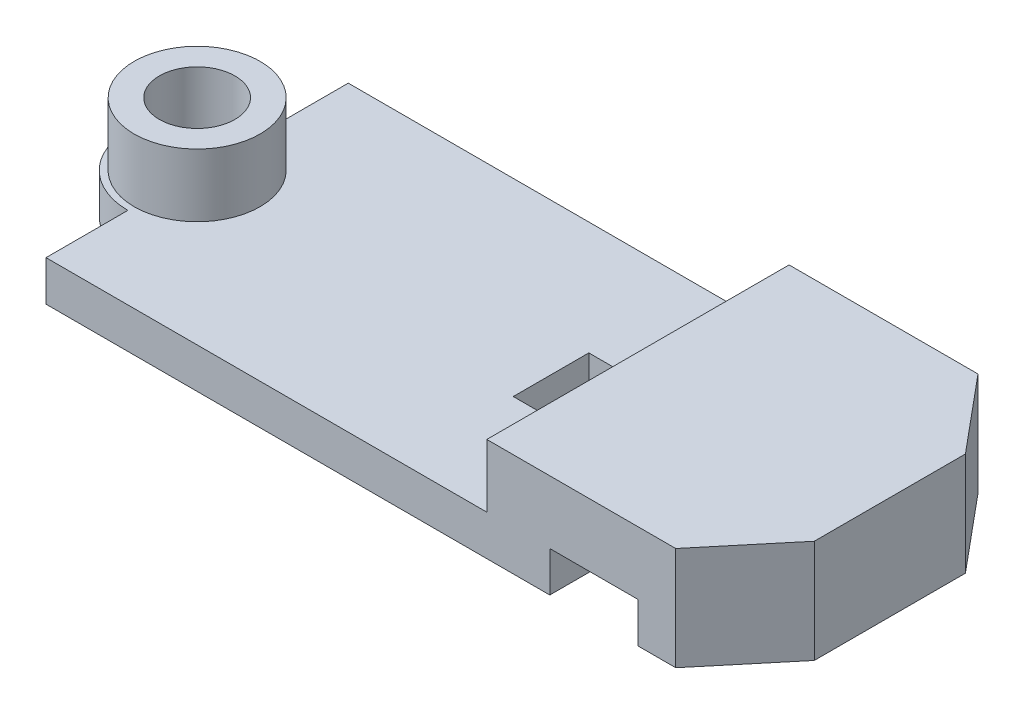
from build123d import *

# Parameters (mm, degrees)
CROQUIS1_W              = 175
CROQUIS1_H              = 120
SALIENTE_EXTRUIR1_DEPTH = 16
SALIENTE_EXTRUIR3_DEPTH = 41
CROQUIS7_W              = 35
CROQUIS7_H              = 16
CORTAR_EXTRUIR1_DEPTH   = 227.356466663
CROQUIS11_W             = 25
CROQUIS11_H             = 30
CORTAR_EXTRUIR2_DEPTH   = 199.447096225
CROQUIS12_R             = 25
SALIENTE_EXTRUIR4_DEPTH = 25
CROQUIS14_R             = 27.5
SALIENTE_EXTRUIR7_DEPTH = 16
SALIENTE_EXTRUIR8_START = 30
SALIENTE_EXTRUIR8_DEPTH = 30
SALIENTE_EXTRUIR9_DEPTH = 30
CROQUIS17_R             = 15
CORTAR_EXTRUIR3_DEPTH   = 210.277925257


with BuildPart() as part:
    # Croquis1 → Saliente-Extruir1 (new body)
    with BuildSketch(Plane(origin=(0, 0, 0), x_dir=(1, 0, 0), z_dir=(0, 1, 0))):
        Rectangle(CROQUIS1_W, CROQUIS1_H)
    extrude(amount=SALIENTE_EXTRUIR1_DEPTH)

    # Croquis6 → Saliente-Extruir3 (add)
    with BuildSketch(Plane.XZ):
        Polygon((87.5, 60), (162.5, 60), (187.5, 30), (187.5, -30), (162.5, -60), (87.5, -60), align=None)
    extrude(amount=-SALIENTE_EXTRUIR3_DEPTH)

    # Croquis7 → Cortar-Extruir1 (cut, through all)
    with BuildSketch(Plane.XY.offset(60)):
        with Locations((130, 8)):
            Rectangle(CROQUIS7_W, CROQUIS7_H)
    extrude(amount=-CORTAR_EXTRUIR1_DEPTH, mode=Mode.SUBTRACT)

    # Croquis11 → Cortar-Extruir2 (cut, through all)
    with BuildSketch(Plane(origin=(0, 16, 0), x_dir=(1, 0, 0), z_dir=(0, 1, 0))):
        with Locations((65.5, 0)):
            Rectangle(CROQUIS11_W, CROQUIS11_H)
    extrude(amount=-CORTAR_EXTRUIR2_DEPTH, mode=Mode.SUBTRACT)

    # Croquis12 → Saliente-Extruir4 (add)
    with BuildSketch(Plane(origin=(0, 16, 0), x_dir=(1, 0, 0), z_dir=(0, 1, 0))):
        with Locations(Location((-87.5, 0, 0), (0, 0, 270))):
            Circle(CROQUIS12_R)
    extrude(amount=SALIENTE_EXTRUIR4_DEPTH)

    # Croquis14 → Saliente-Extruir7 (add)
    with BuildSketch(Plane.XZ):
        with Locations((-87.5, 0)):
            Circle(CROQUIS14_R)
    extrude(amount=-SALIENTE_EXTRUIR7_DEPTH)

    # Croquis15 → Saliente-Extruir8 (add)
    with BuildSketch(Plane(origin=(0, 0, 0), x_dir=(-1, 0, 0), z_dir=(0, -1, 0)).offset(SALIENTE_EXTRUIR8_START)):
        with BuildLine():
            Line((87.5, 25), (87.5, -25))
            ThreePointArc((87.5, -25), (112.5, 0), (87.5, 25))
        make_face()
    extrude(amount=-SALIENTE_EXTRUIR8_DEPTH)

    # Croquis16 → Saliente-Extruir9 (add)
    with BuildSketch(Plane.XZ):
        with BuildLine():
            Line((-87.5, 30), (-87.5, -30))
            ThreePointArc((-87.5, -30), (-57.5, 0), (-87.5, 30))
        make_face()
    extrude(amount=SALIENTE_EXTRUIR9_DEPTH)

    # Croquis17 → Cortar-Extruir3 (cut, through all)
    with BuildSketch(Plane(origin=(0, 41, 0), x_dir=(1, 0, 0), z_dir=(0, 1, 0))):
        with Locations(Location((-87.5, 0, 0), (0, 0, 270))):
            Circle(CROQUIS17_R)
    extrude(amount=-CORTAR_EXTRUIR3_DEPTH, mode=Mode.SUBTRACT)


solid = part.part
